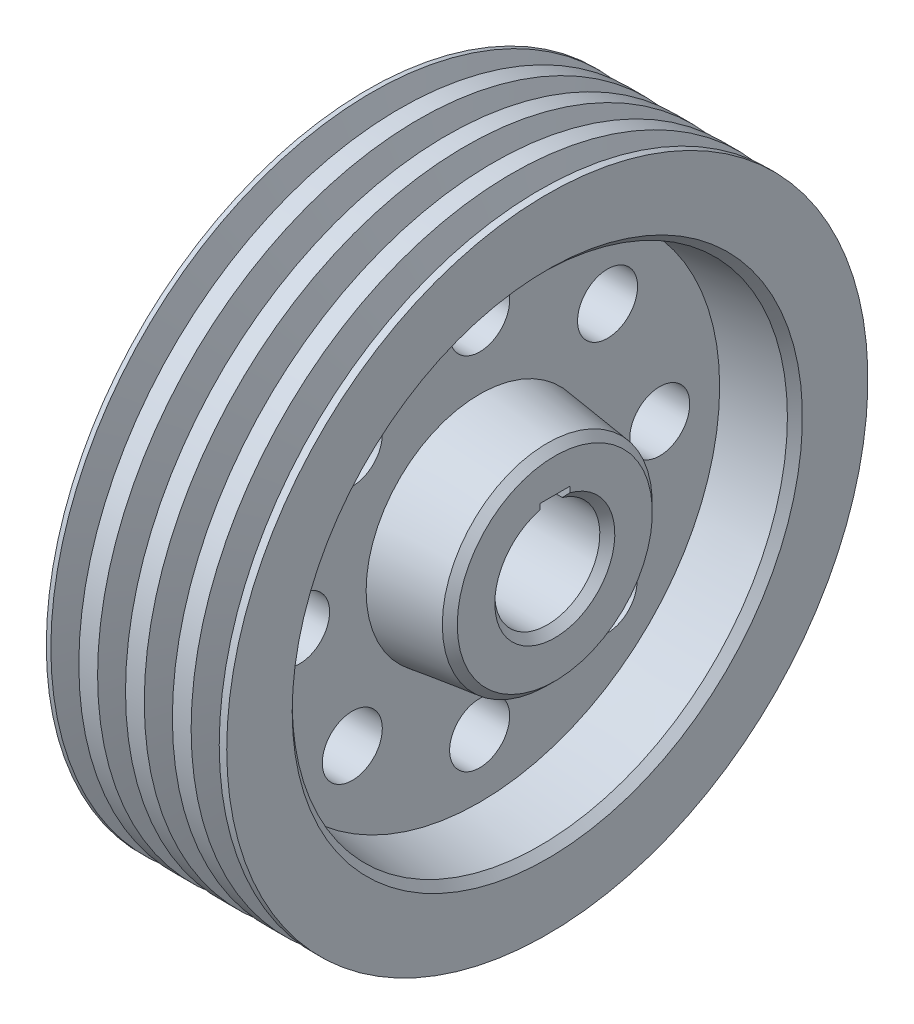
from build123d import *

# Parameters (mm, degrees)
CUT_EXTRUDE_1_DEPTH      = 126.12457566
CUT_EXTRUDE_1_DEPTH_BACK = 126.12457566
SKETCH_3_R               = 8
CUT_EXTRUDE_7_DEPTH      = 132.675249315
CUT_EXTRUDE_7_DEPTH_BACK = 100
SKETCH_4_W               = 8
SKETCH_4_H               = 4.126409889


with BuildPart() as part:
    # 草图2 → 旋转1 (revolve)
    with BuildSketch(Plane.XY, mode=Mode.PRIVATE) as revolve_1_sk:
        Polygon((2, 27.983551403), (0, 26), (0, 16), (2, 14), (50, 14), (52, 16), (52, 26), (50, 27.983551403), (31.96542119, 30.261848535), (31.96542119, 63.974361625), (48, 66), (50, 68), (50, 85.45), (48, 85.45), (45.286294211, 77.568826128), (43.286294211, 77.568826128), (40.556999042, 85.495274844), (35.556999042, 85.495274844), (32.843293253, 77.614100973), (30.843293253, 77.614100973), (28.113998085, 85.540549689), (23.113998085, 85.540549689), (20.400292296, 77.659375817), (18.400292296, 77.614100973), (15.670997127, 85.540549689), (10.670997127, 85.540549689), (7.941701959, 77.614100973), (5.941701959, 77.614100973), (3.212406791, 85.540549689), (2, 85.540549689), (2, 68), (4, 66), (20, 63.978729945), (20, 30.261848535), align=None)
    revolve(revolve_1_sk.sketch.rotate(Axis((0, 0, 0), (1, 0, 0)), 90), axis=Axis((0, 0, 0), (1, 0, 0)))

    # 草图3 → 切除-拉伸1 (cut, two sides: drawn at the far end of the back side and taken through both)
    with BuildSketch(Plane(origin=(31.96542119, 0, 0), x_dir=(0, 0, -1), z_dir=(1, 0, 0)).offset(-CUT_EXTRUDE_1_DEPTH_BACK)):
        with Locations((34.095485037, 34.095485037)):
            Circle(SKETCH_3_R)
        with Locations((0, 48)):
            Circle(SKETCH_3_R)
        with Locations((-33.941125497, 33.941125497)):
            Circle(SKETCH_3_R)
        with Locations((-48, 0)):
            Circle(SKETCH_3_R)
        with Locations((0, -48)):
            Circle(SKETCH_3_R)
        with Locations((48, 0)):
            Circle(SKETCH_3_R)
        with Locations((33.941125497, -33.941125497)):
            Circle(SKETCH_3_R)
        with Locations((-33.941125497, -33.941125497)):
            Circle(SKETCH_3_R)
    extrude(amount=CUT_EXTRUDE_1_DEPTH + CUT_EXTRUDE_1_DEPTH_BACK, mode=Mode.SUBTRACT)

    # 草图4 → 切除-拉伸7 (cut, two sides: drawn at the far end of the back side and taken through both)
    with BuildSketch(Plane(origin=(0, 0, 0), x_dir=(0, 0, -1), z_dir=(1, 0, 0)).offset(-CUT_EXTRUDE_7_DEPTH_BACK)):
        with Locations((0.004765376, 14.936795055)):
            Rectangle(SKETCH_4_W, SKETCH_4_H)
    extrude(amount=CUT_EXTRUDE_7_DEPTH + CUT_EXTRUDE_7_DEPTH_BACK, mode=Mode.SUBTRACT)


solid = part.part
